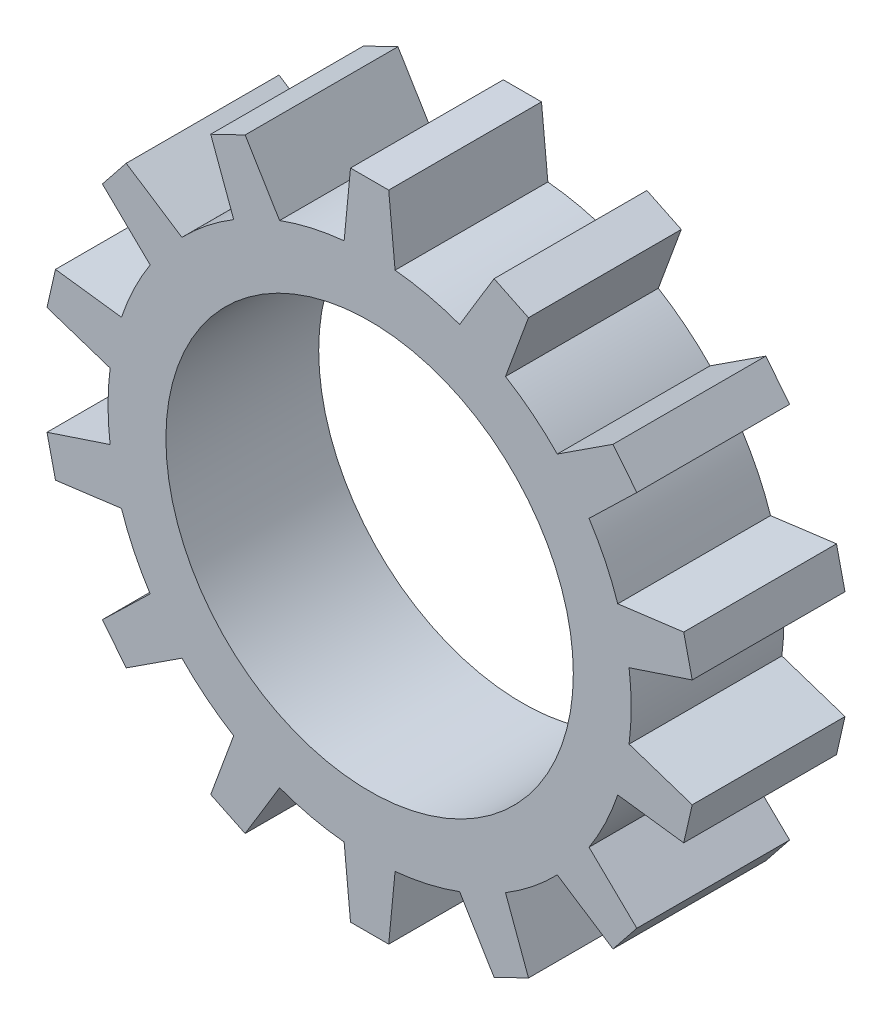
from build123d import *

# Parameters (mm, degrees)
CROQUIS1_R              = 4
SALIENTE_EXTRUIR1_DEPTH = 3


with BuildPart() as part:
    # Croquis1 → Saliente-Extruir1 (new body)
    with BuildSketch(Plane.XY):
        with BuildLine():
            Line((-0.5, 5.111716619), (-0.375, 6.411716619))
            Line((-0.375, 6.411716619), (0.375, 6.411716619))
            Line((0.375, 6.411716619), (0.5, 5.111716619))
            ThreePointArc((0.5, 5.111716619), (1.142892446, 5.007338979), (1.767406286, 4.822439404))
            Line((1.767406286, 4.822439404), (2.444076255, 5.939463465))
            Line((2.444076255, 5.939463465), (3.119802906, 5.614050661))
            Line((3.119802906, 5.614050661), (2.668375154, 4.388555665))
            ThreePointArc((2.668375154, 4.388555665), (3.202313472, 4.015574083), (3.684756081, 3.578018923))
            Line((3.684756081, 3.578018923), (4.779073233, 4.29082673))
            Line((4.779073233, 4.29082673), (5.246690585, 3.704453118))
            Line((5.246690585, 3.704453118), (4.308245883, 2.79618744))
            ThreePointArc((4.308245883, 2.79618744), (4.627477041, 2.228475492), (4.872294744, 1.624927912))
            Line((4.872294744, 1.624927912), (6.167516146, 1.792339137))
            Line((6.167516146, 1.792339137), (6.334406847, 1.061143203))
            Line((6.334406847, 1.061143203), (5.094815678, 0.65))
            ThreePointArc((5.094815678, 0.65), (5.13611203, 0), (5.094815678, -0.65))
            Line((5.094815678, -0.65), (6.334406847, -1.061143203))
            Line((6.334406847, -1.061143203), (6.167516146, -1.792339137))
            Line((6.167516146, -1.792339137), (4.872294744, -1.624927912))
            ThreePointArc((4.872294744, -1.624927912), (4.627477041, -2.228475492), (4.308245883, -2.79618744))
            Line((4.308245883, -2.79618744), (5.246690585, -3.704453118))
            Line((5.246690585, -3.704453118), (4.779073233, -4.29082673))
            Line((4.779073233, -4.29082673), (3.684756081, -3.578018923))
            ThreePointArc((3.684756081, -3.578018923), (3.202313472, -4.015574083), (2.668375154, -4.388555665))
            Line((2.668375154, -4.388555665), (3.119802906, -5.614050661))
            Line((3.119802906, -5.614050661), (2.444076255, -5.939463465))
            Line((2.444076255, -5.939463465), (1.767406286, -4.822439404))
            ThreePointArc((1.767406286, -4.822439404), (1.142892446, -5.007338979), (0.5, -5.111716619))
            Line((0.5, -5.111716619), (0.375, -6.411716619))
            Line((0.375, -6.411716619), (-0.375, -6.411716619))
            Line((-0.375, -6.411716619), (-0.5, -5.111716619))
            ThreePointArc((-0.5, -5.111716619), (-1.142892446, -5.007338979), (-1.767406286, -4.822439404))
            Line((-1.767406286, -4.822439404), (-2.444076255, -5.939463465))
            Line((-2.444076255, -5.939463465), (-3.119802906, -5.614050661))
            Line((-3.119802906, -5.614050661), (-2.668375154, -4.388555665))
            ThreePointArc((-2.668375154, -4.388555665), (-3.202313472, -4.015574083), (-3.684756081, -3.578018923))
            Line((-3.684756081, -3.578018923), (-4.779073233, -4.29082673))
            Line((-4.779073233, -4.29082673), (-5.246690585, -3.704453118))
            Line((-5.246690585, -3.704453118), (-4.308245883, -2.79618744))
            ThreePointArc((-4.308245883, -2.79618744), (-4.627477041, -2.228475492), (-4.872294744, -1.624927912))
            Line((-4.872294744, -1.624927912), (-6.167516146, -1.792339137))
            Line((-6.167516146, -1.792339137), (-6.334406847, -1.061143203))
            Line((-6.334406847, -1.061143203), (-5.094815678, -0.65))
            ThreePointArc((-5.094815678, -0.65), (-5.13611203, 0), (-5.094815678, 0.65))
            Line((-5.094815678, 0.65), (-6.334406847, 1.061143203))
            Line((-6.334406847, 1.061143203), (-6.167516146, 1.792339137))
            Line((-6.167516146, 1.792339137), (-4.872294744, 1.624927912))
            ThreePointArc((-4.872294744, 1.624927912), (-4.627477041, 2.228475492), (-4.308245883, 2.79618744))
            Line((-4.308245883, 2.79618744), (-5.246690585, 3.704453118))
            Line((-5.246690585, 3.704453118), (-4.779073233, 4.29082673))
            Line((-4.779073233, 4.29082673), (-3.684756081, 3.578018923))
            ThreePointArc((-3.684756081, 3.578018923), (-3.202313472, 4.015574083), (-2.668375154, 4.388555665))
            Line((-2.668375154, 4.388555665), (-3.119802906, 5.614050661))
            Line((-3.119802906, 5.614050661), (-2.444076255, 5.939463465))
            Line((-2.444076255, 5.939463465), (-1.767406286, 4.822439404))
            ThreePointArc((-1.767406286, 4.822439404), (-1.142892446, 5.007338979), (-0.5, 5.111716619))
        make_face()
        Circle(CROQUIS1_R, mode=Mode.SUBTRACT)
    extrude(amount=SALIENTE_EXTRUIR1_DEPTH)


solid = part.part
